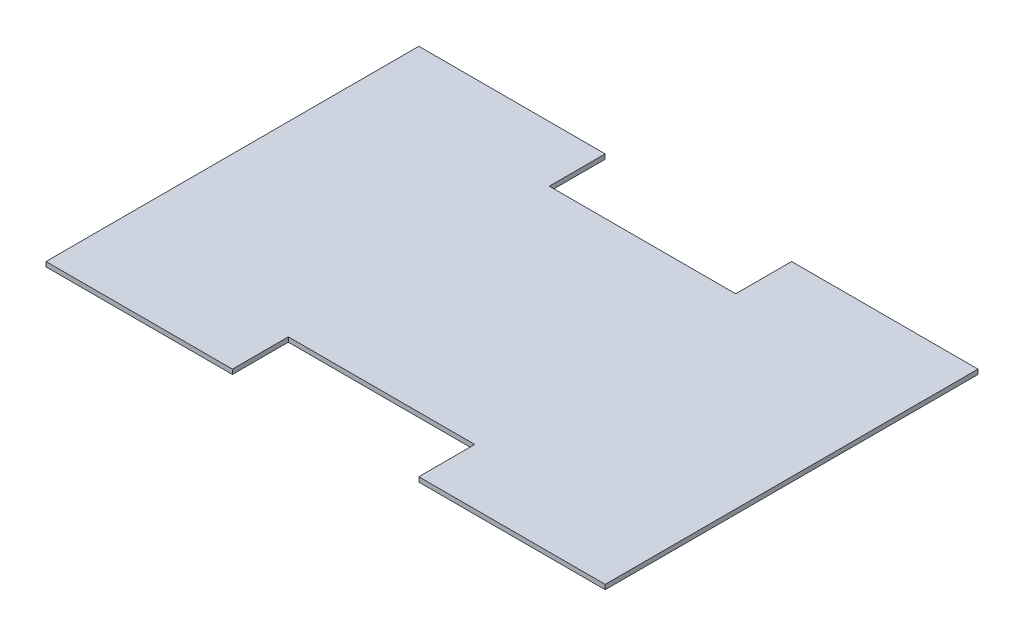
from build123d import *

# Parameters (mm, degrees)
SKETCH1_W           = 600
SKETCH1_H           = 400
BOSS_EXTRUDE1_DEPTH = 5
SKETCH2_W           = 100
SKETCH2_H           = 60
SKETCH2_W_2         = 200
CUT_EXTRUDE1_DEPTH  = 361.589794642


with BuildPart() as part:
    # Sketch1 → Boss-Extrude1 (new body)
    with BuildSketch(Plane(origin=(0, 0, 0), x_dir=(1, 0, 0), z_dir=(0, 1, 0))):
        Rectangle(SKETCH1_W, SKETCH1_H)
    extrude(amount=BOSS_EXTRUDE1_DEPTH)

    # Sketch2 → Cut-Extrude1 (cut, through all)
    with BuildSketch(Plane(origin=(0, 5, 0), x_dir=(1, 0, 0), z_dir=(0, 1, 0))):
        with Locations((-50, 170)):
            Rectangle(SKETCH2_W, SKETCH2_H)
        with Locations((50, 170)):
            Rectangle(SKETCH2_W, SKETCH2_H)
        with Locations((0, -170)):
            Rectangle(SKETCH2_W_2, SKETCH2_H)
    extrude(amount=-CUT_EXTRUDE1_DEPTH, mode=Mode.SUBTRACT)


solid = part.part
